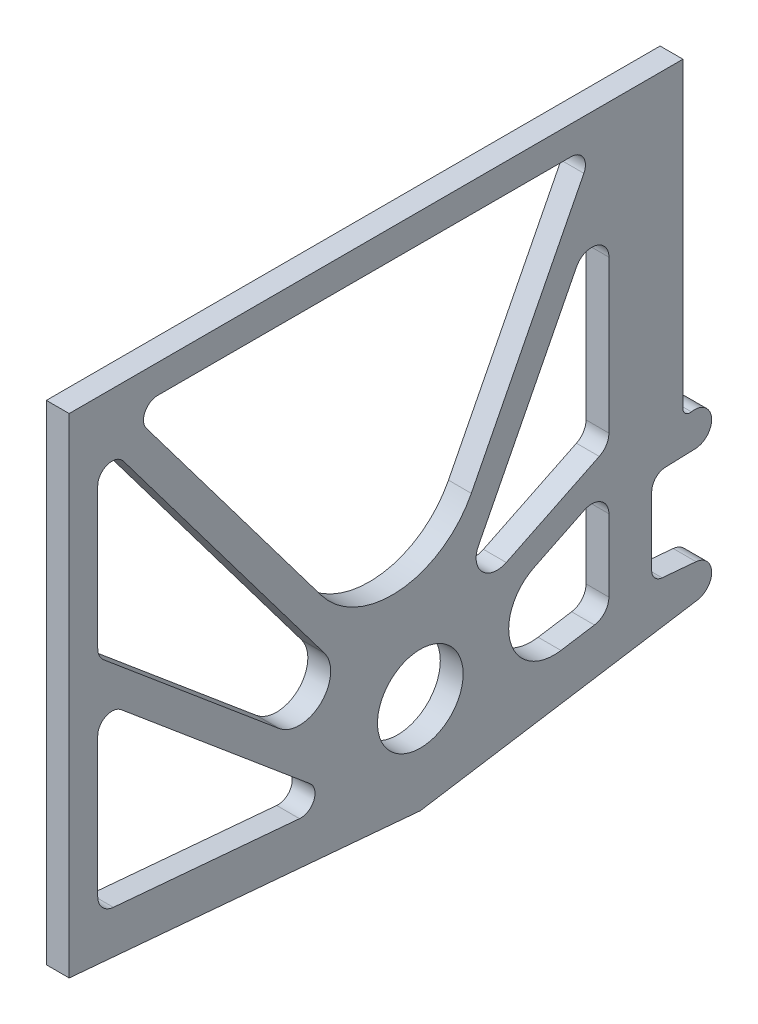
from build123d import *

# Parameters (mm, degrees)
SKETCH2_R   = 15
FRAME_DEPTH = 8


with BuildPart() as part:
    # Sketch2 → frame (new body)
    with BuildSketch(Plane(origin=(0, 0, 0), x_dir=(0, 0, -1), z_dir=(1, 0, 0))):
        with BuildLine():
            Line((0, -34), (-123, -23.238894386))
            Line((-123, -23.238894386), (-123, 148))
            Line((-123, 148), (92, 148))
            Line((92, 148), (92, 42))
            ThreePointArc((92, 42), (92.902828006, 40.076710729), (94.959233297, 39.542540991))
            ThreePointArc((94.959233297, 39.542540991), (102.025285395, 34.301898835), (96.270058953, 27.648268918))
            Line((96.270058953, 27.648268918), (85.887505091, 27.286969807))
            ThreePointArc((85.887505091, 27.286969807), (82.464905993, 25.763505578), (81.06139321, 22.289994429))
            Line((81.06139321, 22.289994429), (81.06139321, -1.710005571))
            ThreePointArc((81.06139321, -1.710005571), (82.112283863, -4.412366401), (84.712770239, -5.694784363))
            Line((84.712770239, -5.694784363), (96.584327666, -6.733411056))
            ThreePointArc((96.584327666, -6.733411056), (102.057738172, -12.501182265), (97, -18.636709289))
            Line((97, -18.636709289), (0, -34))
        make_face()
        Circle(SKETCH2_R, mode=Mode.SUBTRACT)
        with BuildLine():
            Line((-113, -3.558496414), (-113, 45.220981939))
            ThreePointArc((-113, 45.220981939), (-110.113091309, 49.752520874), (-104.786061952, 49.051204155))
            Line((-104.786061952, 49.051204155), (-38.667003468, -6.429273433))
            ThreePointArc((-38.667003468, -6.429273433), (-37.261543853, -12.172912811), (-42.31672023, -15.240469139))
            Line((-42.31672023, -15.240469139), (-107.522934456, -9.535664603))
            ThreePointArc((-107.522934456, -9.535664603), (-111.423664021, -7.61203766), (-113, -3.558496414))
        make_face(mode=Mode.SUBTRACT)
        with BuildLine():
            Line((-113, 71.795435384), (-113, 121.054164621))
            ThreePointArc((-113, 121.054164621), (-109.586523282, 125.795782897), (-104.00682245, 124.063239737))
            Line((-104.00682245, 124.063239737), (-33.611864664, 30.645975539))
            ThreePointArc((-33.611864664, 30.645975539), (-34.821190136, 16.092200216), (-49.418311221, 15.646217831))
            Line((-49.418311221, 15.646217831), (-110.856725658, 67.199168725))
            ThreePointArc((-110.856725658, 67.199168725), (-112.437846722, 69.259725813), (-113, 71.795435384))
        make_face(mode=Mode.SUBTRACT)
        with BuildLine():
            Line((-91.959119468, 138), (52.842661319, 138))
            ThreePointArc((52.842661319, 138), (57.105862141, 135.612492824), (57.29769394, 130.730047501))
            Line((57.29769394, 130.730047501), (17.87282228, 53.354380202))
            ThreePointArc((17.87282228, 53.354380202), (-7.155112396, 36.472825104), (-34.734267785, 48.7518562))
            Line((-34.734267785, 48.7518562), (-95.952297019, 129.990924884))
            ThreePointArc((-95.952297019, 129.990924884), (-96.433791276, 135.230989066), (-91.959119468, 138))
        make_face(mode=Mode.SUBTRACT)
        with BuildLine():
            Line((66.06139321, 100.911084489), (66.06139321, 47.537774319))
            ThreePointArc((66.06139321, 47.537774319), (65.149681787, 44.358258734), (62.69162009, 42.145010042))
            Line((62.69162009, 42.145010042), (30.109631358, 26.253712336))
            ThreePointArc((30.109631358, 26.253712336), (21.653823385, 27.706685885), (20.348645329, 36.186563882))
            Line((20.348645329, 36.186563882), (54.715354065, 103.635027487))
            ThreePointArc((54.715354065, 103.635027487), (61.462065393, 106.745304011), (66.06139321, 100.911084489))
        make_face(mode=Mode.SUBTRACT)
        with BuildLine():
            Line((66.06139321, 23.060531629), (66.06139321, -2.212977084))
            ThreePointArc((66.06139321, -2.212977084), (64.623829003, -6.109665374), (61, -8.139107128))
            Line((61, -8.139107128), (49.27069142, -9.996847102))
            ThreePointArc((49.27069142, -9.996847102), (31.689538707, 0.882700312), (39.850923857, 19.878838738))
            Line((39.850923857, 19.878838738), (57.431166329, 28.453295907))
            ThreePointArc((57.431166329, 28.453295907), (63.240908795, 28.148820206), (66.06139321, 23.060531629))
        make_face(mode=Mode.SUBTRACT)
    extrude(amount=FRAME_DEPTH)


solid = part.part
